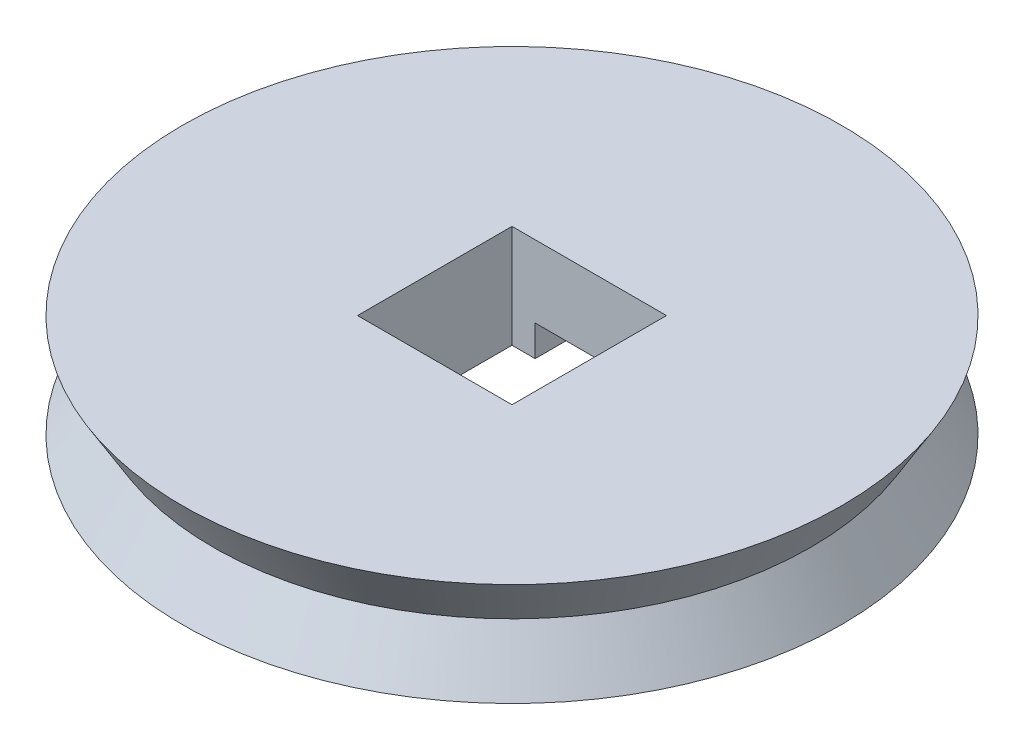
from build123d import *

# Parameters (mm, degrees)
SKETCH1_R           = 32
BOSS_EXTRUDE1_DEPTH = 10
SKETCH3_W           = 15
SKETCH3_H           = 15
CUT_EXTRUDE1_DEPTH  = 47.346520905
SKETCH4_W           = 10.5
SKETCH4_H           = 10.5
CUT_EXTRUDE2_DEPTH  = 3


with BuildPart() as part:
    # Sketch1 → Boss-Extrude1 (new body)
    with BuildSketch(Plane(origin=(0, 0, 0), x_dir=(1, 0, 0), z_dir=(0, 1, 0))):
        Circle(SKETCH1_R)
    extrude(amount=BOSS_EXTRUDE1_DEPTH)

    # Cut-Sweep1: sweep along a path in Sketch1<2>
    with BuildLine(Plane(origin=(0, 0, 0), x_dir=(1, 0, 0), z_dir=(0, 1, 0))) as cut_sweep1_path:
        CenterArc((0, 0), 32, 0, 360)
    # Sketch2 → Cut-Sweep1 (sweep, cut)
    with BuildSketch(Plane.XY):
        Polygon((32, 10), (29, 5), (32, 0), align=None)
    sweep(path=cut_sweep1_path.line, mode=Mode.SUBTRACT)

    # Sketch3 → Cut-Extrude1 (cut, through all)
    with BuildSketch(Plane(origin=(0, 10, 0), x_dir=(1, 0, 0), z_dir=(0, 1, 0))):
        Rectangle(SKETCH3_W, SKETCH3_H)
    extrude(amount=-CUT_EXTRUDE1_DEPTH, mode=Mode.SUBTRACT)

    # Sketch4 → Cut-Extrude2 (cut)
    with BuildSketch(Plane.XZ):
        with Locations((0, 12.75)):
            Rectangle(SKETCH4_W, SKETCH4_H)
        with Locations((0, -12.75)):
            Rectangle(SKETCH4_W, SKETCH4_H)
    extrude(amount=-CUT_EXTRUDE2_DEPTH, mode=Mode.SUBTRACT)


solid = part.part
